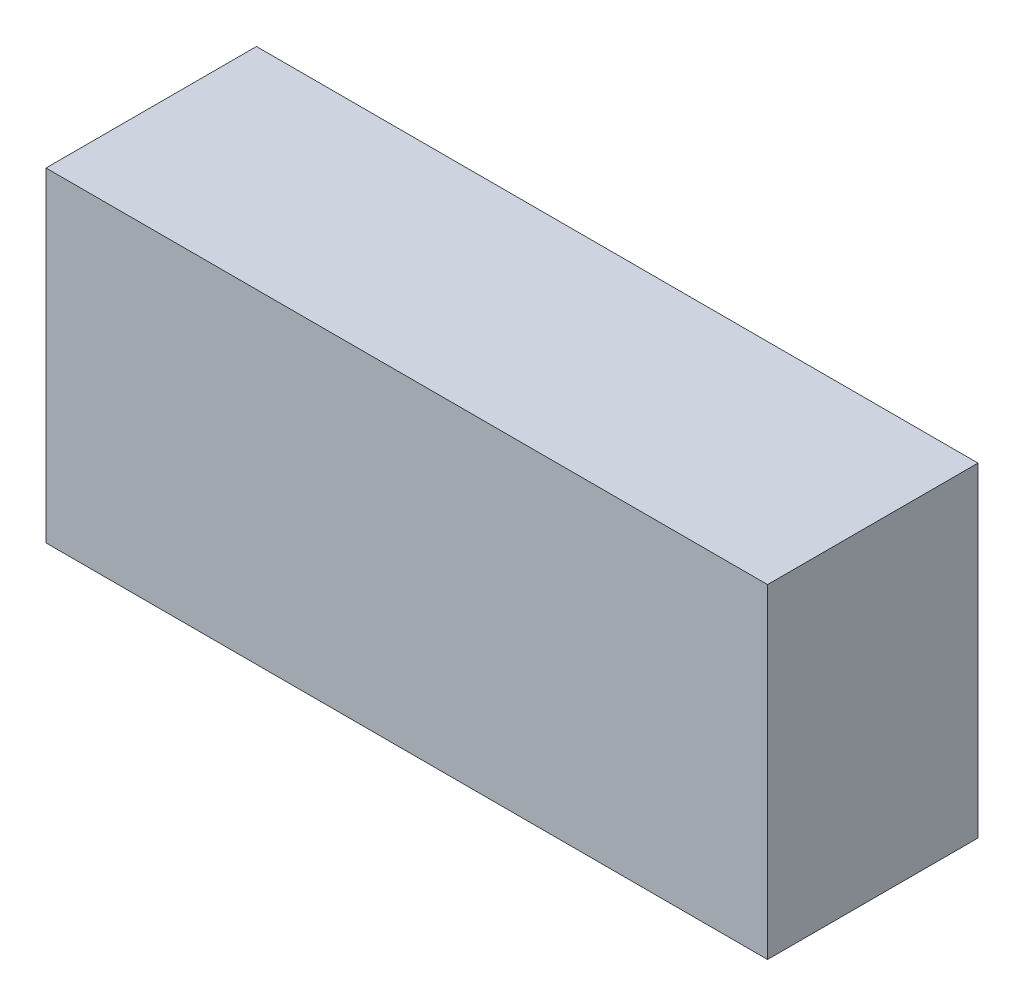
from build123d import *

# Parameters (mm, degrees)
SKETCH1_W           = 120
SKETCH1_H           = 35
BOSS_EXTRUDE1_DEPTH = 54


with BuildPart() as part:
    # Sketch1 → Boss-Extrude1 (new body)
    with BuildSketch(Plane(origin=(0, 0, 0), x_dir=(1, 0, 0), z_dir=(0, 1, 0))):
        with Locations((-13.052797401, -15.985511158)):
            Rectangle(SKETCH1_W, SKETCH1_H)
    extrude(amount=BOSS_EXTRUDE1_DEPTH)


solid = part.part
